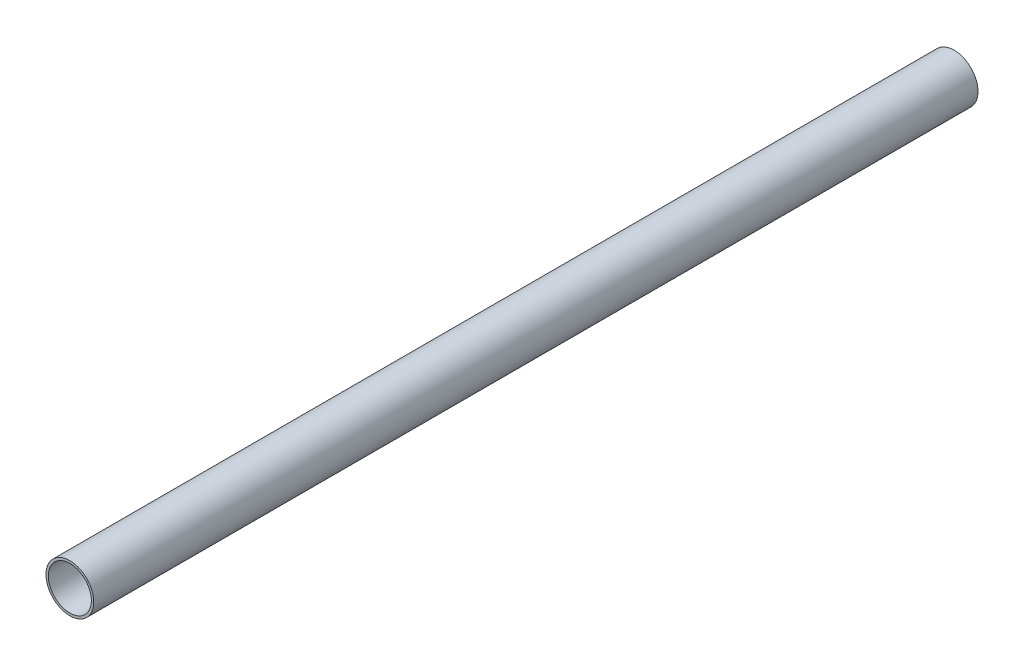
from build123d import *

# Parameters (mm, degrees)
SKETCH1_R           = 10
SKETCH1_R_2         = 9
BOSS_EXTRUDE1_DEPTH = 370


with BuildPart() as part:
    # Sketch1 → Boss-Extrude1 (new body)
    with BuildSketch(Plane.XY):
        Circle(SKETCH1_R)
        Circle(SKETCH1_R_2, mode=Mode.SUBTRACT)
    extrude(amount=BOSS_EXTRUDE1_DEPTH)


solid = part.part
